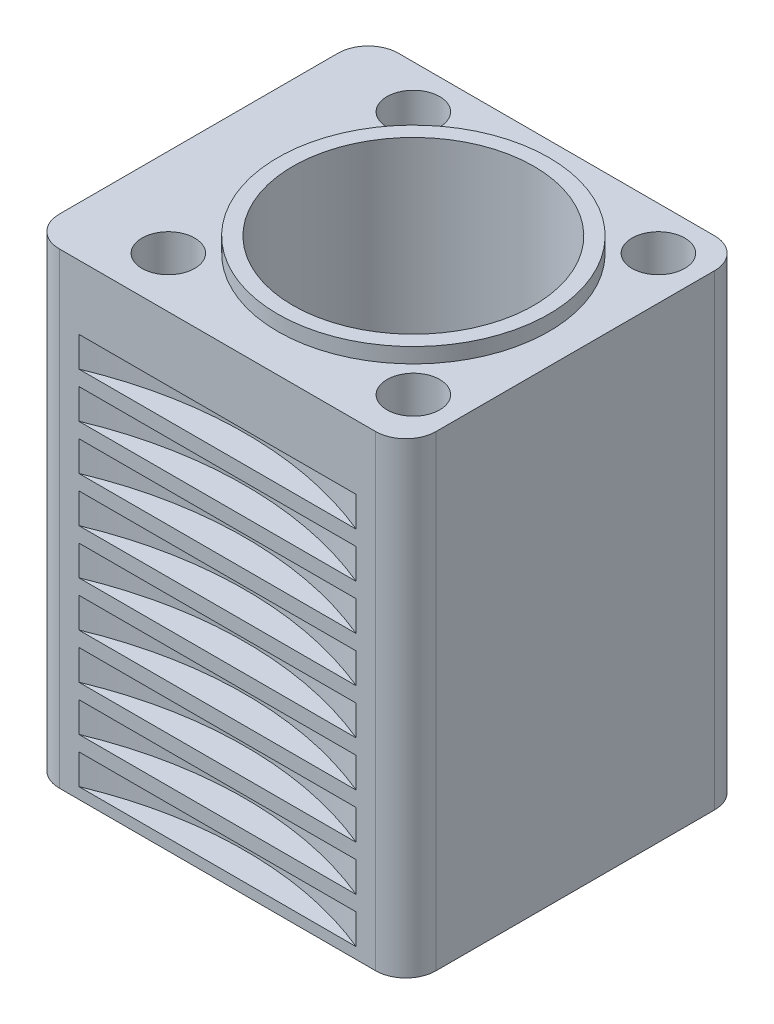
from build123d import *

# Parameters (mm, degrees)
BOSS_EXTRUDE1_DEPTH     = 62
SKETCH2_R               = 18
BOSS_EXTRUDE2_DEPTH     = 2
SKETCH3_R               = 16
CUT_EXTRUDE1_DEPTH      = 74.545904033
CUT_EXTRUDE2_DEPTH      = 2
SKETCH5_R               = 3.5
CUT_EXTRUDE3_DEPTH      = 74.545904033
SKETCH7_W               = 48
SKETCH7_H               = 4
LPATTERN1_COUNT         = 9
LPATTERN1_PITCH         = 6
MIRROR1_COPY_1_SKETCH_W = 48
MIRROR1_COPY_1_SKETCH_H = 4
MIRROR1_COPY_2_SKETCH_W = 48
MIRROR1_COPY_2_SKETCH_H = 4
MIRROR1_COPY_3_SKETCH_W = 48
MIRROR1_COPY_3_SKETCH_H = 4
MIRROR1_COPY_4_SKETCH_W = 48
MIRROR1_COPY_4_SKETCH_H = 4
MIRROR1_COPY_5_SKETCH_W = 48
MIRROR1_COPY_5_SKETCH_H = 4
MIRROR1_COPY_6_SKETCH_W = 48
MIRROR1_COPY_6_SKETCH_H = 4
MIRROR1_COPY_7_SKETCH_W = 48
MIRROR1_COPY_7_SKETCH_H = 4
MIRROR1_COPY_8_SKETCH_W = 48
MIRROR1_COPY_8_SKETCH_H = 4
SKETCH10_W              = 48
SKETCH10_H              = 4
LPATTERN2_COUNT         = 9
LPATTERN2_PITCH         = 6


with BuildPart() as part:
    # Sketch1 → Boss-Extrude1 (new body)
    with BuildSketch(Plane(origin=(0, 0, 0), x_dir=(1, 0, 0), z_dir=(0, 1, 0))):
        with BuildLine():
            Line((-24, 22), (18, 22))
            ThreePointArc((18, 22), (20.828427125, 20.828427125), (22, 18))
            Line((22, 18), (22, -19))
            ThreePointArc((22, -19), (20.828427125, -21.828427125), (18, -23))
            Line((18, -23), (-24, -23))
            ThreePointArc((-24, -23), (-26.828427125, -21.828427125), (-28, -19))
            Line((-28, -19), (-28, 18))
            ThreePointArc((-28, 18), (-26.828427125, 20.828427125), (-24, 22))
        make_face()
    extrude(amount=BOSS_EXTRUDE1_DEPTH)

    # Sketch2 → Boss-Extrude2 (add)
    with BuildSketch(Plane(origin=(0, 62, 0), x_dir=(1, 0, 0), z_dir=(0, 1, 0))):
        with Locations(Location((0, 0, 0), (0, 0, 270))):
            Circle(SKETCH2_R)
    extrude(amount=BOSS_EXTRUDE2_DEPTH)

    # Sketch3 → Cut-Extrude1 (cut, through all)
    with BuildSketch(Plane(origin=(0, 64, 0), x_dir=(1, 0, 0), z_dir=(0, 1, 0))):
        with Locations(Location((0, 0, 0), (0, 0, 270))):
            Circle(SKETCH3_R)
    extrude(amount=-CUT_EXTRUDE1_DEPTH, mode=Mode.SUBTRACT)

    # Sketch4 → Cut-Extrude2 (cut)
    with BuildSketch(Plane.XZ):
        with BuildLine():
            Line((-20.306853537, -1.994120307), (-20.306853537, -2))
            Line((-20.306853537, -2), (-10.443807973, -2))
            Line((-10.443807973, -2), (-10.443807973, 2))
            Line((-10.443807973, 2), (-20.306853537, 2))
            Line((-20.306853537, 2), (-20.306853537, 1.994120307))
            ThreePointArc((-20.306853537, 1.994120307), (-22.300973844, 0), (-20.306853537, -1.994120307))
        make_face()
    extrude(amount=-CUT_EXTRUDE2_DEPTH, mode=Mode.SUBTRACT)

    # Sketch5 → Cut-Extrude3 (cut, through all)
    with BuildSketch(Plane.XZ):
        with Locations(Location((16.263455967, 16.263455967, 0), (0, 0, 270))):
            Circle(SKETCH5_R)
        with Locations(Location((16.263455967, -16.263455967, 0), (0, 0, 270))):
            Circle(SKETCH5_R)
        with Locations(Location((-16.263455967, -16.263455967, 0), (0, 0, 270))):
            Circle(SKETCH5_R)
        with Locations(Location((-16.263455967, 16.263455967, 0), (0, 0, 270))):
            Circle(SKETCH5_R)
    extrude(amount=-CUT_EXTRUDE3_DEPTH, mode=Mode.SUBTRACT)

    # Sketch7 → Cut-Revolve1 (revolve, cut)
    with BuildSketch(Plane(origin=(-3, 0, 0), x_dir=(0, 0, -1), z_dir=(1, 0, 0))):
        with Locations((43.326339521, 3.479284524)):
            Rectangle(SKETCH7_W, SKETCH7_H)
    cut_revolve1 = revolve(axis=Axis((-3, 5.479284524, -67.326339521), (0, -1, 0)), mode=Mode.SUBTRACT)

    # LPattern1: Cut-Revolve1 ×9
    with Locations(*[(0, i * LPATTERN1_PITCH, 0) for i in range(1, LPATTERN1_COUNT)]):
        add(cut_revolve1, mode=Mode.SUBTRACT)

    # Mirror1: Cut-Revolve1 across plane
    add(cut_revolve1.mirror(Plane.XY), mode=Mode.SUBTRACT)

    # Mirror1 copy 1 sketch → Mirror1 copy 1 (revolve, cut)
    with BuildSketch(Plane(origin=(-3, 6, 0), x_dir=(0, 0, 1), z_dir=(1, 0, 0))):
        with Locations((43.326339521, -3.479284524)):
            Rectangle(MIRROR1_COPY_1_SKETCH_W, MIRROR1_COPY_1_SKETCH_H)
    revolve(axis=Axis((-3, 11.479284524, 67.326339521), (0, 1, 0)), mode=Mode.SUBTRACT)

    # Mirror1 copy 2 sketch → Mirror1 copy 2 (revolve, cut)
    with BuildSketch(Plane(origin=(-3, 12, 0), x_dir=(0, 0, 1), z_dir=(1, 0, 0))):
        with Locations((43.326339521, -3.479284524)):
            Rectangle(MIRROR1_COPY_2_SKETCH_W, MIRROR1_COPY_2_SKETCH_H)
    revolve(axis=Axis((-3, 17.479284524, 67.326339521), (0, 1, 0)), mode=Mode.SUBTRACT)

    # Mirror1 copy 3 sketch → Mirror1 copy 3 (revolve, cut)
    with BuildSketch(Plane(origin=(-3, 18, 0), x_dir=(0, 0, 1), z_dir=(1, 0, 0))):
        with Locations((43.326339521, -3.479284524)):
            Rectangle(MIRROR1_COPY_3_SKETCH_W, MIRROR1_COPY_3_SKETCH_H)
    revolve(axis=Axis((-3, 23.479284524, 67.326339521), (0, 1, 0)), mode=Mode.SUBTRACT)

    # Mirror1 copy 4 sketch → Mirror1 copy 4 (revolve, cut)
    with BuildSketch(Plane(origin=(-3, 24, 0), x_dir=(0, 0, 1), z_dir=(1, 0, 0))):
        with Locations((43.326339521, -3.479284524)):
            Rectangle(MIRROR1_COPY_4_SKETCH_W, MIRROR1_COPY_4_SKETCH_H)
    revolve(axis=Axis((-3, 29.479284524, 67.326339521), (0, 1, 0)), mode=Mode.SUBTRACT)

    # Mirror1 copy 5 sketch → Mirror1 copy 5 (revolve, cut)
    with BuildSketch(Plane(origin=(-3, 30, 0), x_dir=(0, 0, 1), z_dir=(1, 0, 0))):
        with Locations((43.326339521, -3.479284524)):
            Rectangle(MIRROR1_COPY_5_SKETCH_W, MIRROR1_COPY_5_SKETCH_H)
    revolve(axis=Axis((-3, 35.479284524, 67.326339521), (0, 1, 0)), mode=Mode.SUBTRACT)

    # Mirror1 copy 6 sketch → Mirror1 copy 6 (revolve, cut)
    with BuildSketch(Plane(origin=(-3, 36, 0), x_dir=(0, 0, 1), z_dir=(1, 0, 0))):
        with Locations((43.326339521, -3.479284524)):
            Rectangle(MIRROR1_COPY_6_SKETCH_W, MIRROR1_COPY_6_SKETCH_H)
    revolve(axis=Axis((-3, 41.479284524, 67.326339521), (0, 1, 0)), mode=Mode.SUBTRACT)

    # Mirror1 copy 7 sketch → Mirror1 copy 7 (revolve, cut)
    with BuildSketch(Plane(origin=(-3, 42, 0), x_dir=(0, 0, 1), z_dir=(1, 0, 0))):
        with Locations((43.326339521, -3.479284524)):
            Rectangle(MIRROR1_COPY_7_SKETCH_W, MIRROR1_COPY_7_SKETCH_H)
    revolve(axis=Axis((-3, 47.479284524, 67.326339521), (0, 1, 0)), mode=Mode.SUBTRACT)

    # Mirror1 copy 8 sketch → Mirror1 copy 8 (revolve, cut)
    with BuildSketch(Plane(origin=(-3, 48, 0), x_dir=(0, 0, 1), z_dir=(1, 0, 0))):
        with Locations((43.326339521, -3.479284524)):
            Rectangle(MIRROR1_COPY_8_SKETCH_W, MIRROR1_COPY_8_SKETCH_H)
    revolve(axis=Axis((-3, 53.479284524, 67.326339521), (0, 1, 0)), mode=Mode.SUBTRACT)

    # Sketch10 → Cut-Revolve2 (revolve, cut)
    with BuildSketch(Plane.XY):
        with Locations((-49.135889072, 3.369439349)):
            Rectangle(SKETCH10_W, SKETCH10_H)
    cut_revolve2 = revolve(axis=Axis((-73.135889072, 5.369439349, 0), (0, -1, 0)), mode=Mode.SUBTRACT)

    # LPattern2: Cut-Revolve2 ×9
    with Locations(*[(0, i * LPATTERN2_PITCH, 0) for i in range(1, LPATTERN2_COUNT)]):
        add(cut_revolve2, mode=Mode.SUBTRACT)


solid = part.part
